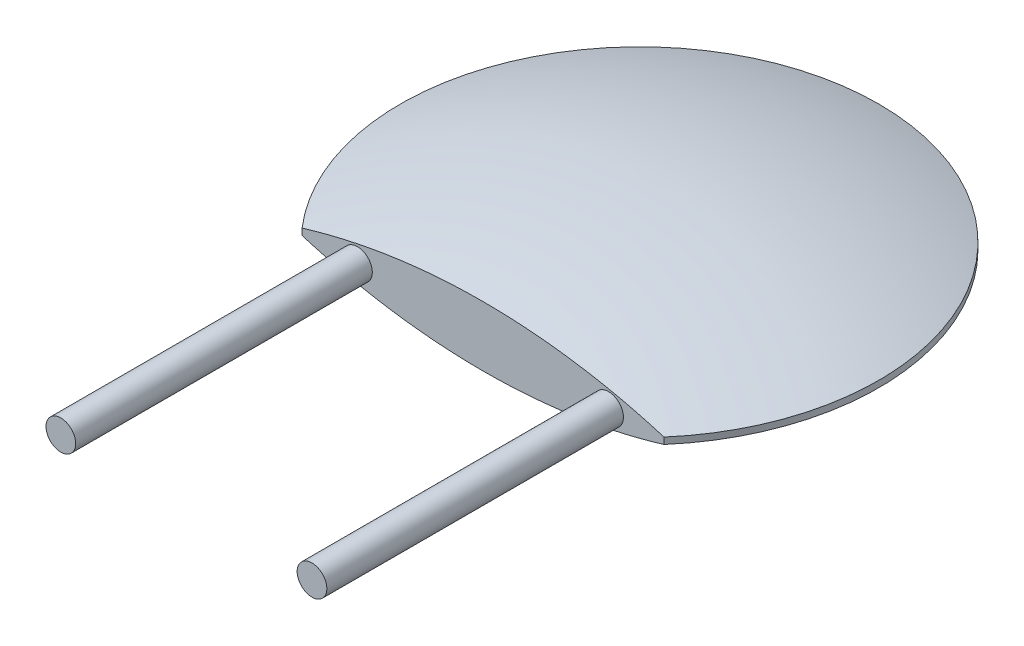
from build123d import *

# Parameters (mm, degrees)
SKETCH_3_W          = 5.794555575
SKETCH_3_H          = 0.933674237
CUT_EXTRUDE_1_DEPTH = 5
SKETCH_4_R          = 0.15
EXTRUDE_1_DEPTH     = 3


with BuildPart() as part:
    # 草图1 → 旋转1 (revolve)
    with BuildSketch(Plane(origin=(0, 0, 0), x_dir=(0, 0, -1), z_dir=(1, 0, 0))):
        with BuildLine():
            Line((0, 0.5), (0, -0.5))
            ThreePointArc((0, -0.5), (1.232422751, -0.38209481), (2.420135029, -0.032656665))
            Line((2.420135029, -0.032656665), (2.420135029, 0.032656665))
            ThreePointArc((2.420135029, 0.032656665), (1.232422751, 0.38209481), (0, 0.5))
        make_face()
    revolve(axis=Axis((0, -1000, 0), (0, 1, 0)))

    # 草图3 → 切除-拉伸1 (cut, symmetric)
    with BuildSketch(Plane(origin=(0, 0, 0), x_dir=(1, 0, 0), z_dir=(0, 1, 0))):
        with Locations((0.081816815, -2.050233119)):
            Rectangle(SKETCH_3_W, SKETCH_3_H)
    extrude(amount=CUT_EXTRUDE_1_DEPTH, both=True, mode=Mode.SUBTRACT)

    # 草图4 → 凸台-拉伸1 (add)
    with BuildSketch(Plane.XY.offset(1.583396)):
        with Locations(Location((-1.27, 0, 0), (0, 0, 180))):
            Circle(SKETCH_4_R)
        with Locations(Location((1.27, 0, 0), (0, 0, 180))):
            Circle(SKETCH_4_R)
    extrude(amount=EXTRUDE_1_DEPTH)


solid = part.part
